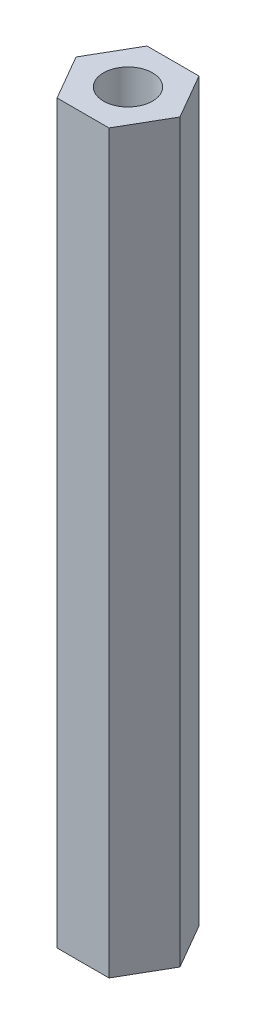
from build123d import *

# Parameters (mm, degrees)
BOSS_EXTRUDE1_DEPTH = 45
SKETCH2_R           = 1.5
CUT_EXTRUDE1_DEPTH  = 10


with BuildPart() as part:
    # Sketch1 → Boss-Extrude1 (new body)
    with BuildSketch(Plane(origin=(0, 0, 0), x_dir=(1, 0, 0), z_dir=(0, 1, 0))):
        Polygon((3.175426481, 0), (1.58771324, 2.75), (-1.58771324, 2.75), (-3.175426481, 0), (-1.58771324, -2.75), (1.58771324, -2.75), align=None)
    extrude(amount=BOSS_EXTRUDE1_DEPTH)

    # Sketch2 → Cut-Extrude1 (cut)
    with BuildSketch(Plane(origin=(0, 45, 0), x_dir=(1, 0, 0), z_dir=(0, 1, 0))):
        with Locations(Location((0, 0, 0), (0, 0, 270))):
            Circle(SKETCH2_R)
    cut_extrude1 = extrude(amount=-CUT_EXTRUDE1_DEPTH, mode=Mode.SUBTRACT)

    # Mirror1: Cut-Extrude1 across plane
    add(cut_extrude1.mirror(Plane(origin=(0, 22.5, 0), x_dir=(0, 0, 1), z_dir=(0, -1, 0))), mode=Mode.SUBTRACT)


solid = part.part
